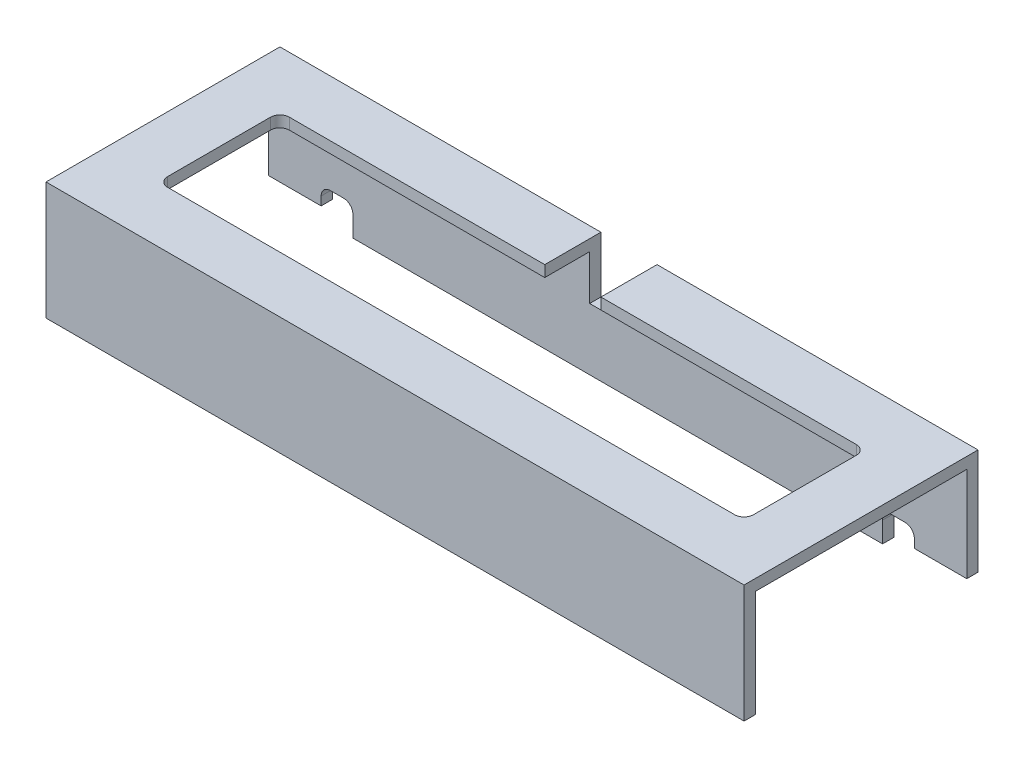
from build123d import *

# Parameters (mm, degrees)
BOSS_EXTRUDE1_DEPTH      = 311.5
BOSS_EXTRUDE1_DEPTH_BACK = 61.5
SKETCH2_R                = 4.34
SKETCH2_W                = 30
SKETCH2_H                = 24
SKETCH2_H_2              = 6
CORTAR_EXTRUIR1_DEPTH    = 30
CORTAR_EXTRUIR3_REACH    = 343.506
REDONDEO1_R              = 5


with BuildPart() as part:
    # Sketch1 → Boss-Extrude1 (new, two sides: drawn at the far end of the back side and taken through both)
    with BuildSketch(Plane(origin=(0, 0, 0), x_dir=(0, 0, -1), z_dir=(1, 0, 0)).offset(-BOSS_EXTRUDE1_DEPTH_BACK)):
        Polygon((0, 0), (6, 0), (6, 57), (119, 57), (119, 0), (125, 0), (125, 63), (0, 63), align=None)
    extrude(amount=BOSS_EXTRUDE1_DEPTH + BOSS_EXTRUDE1_DEPTH_BACK)

    # Sketch2 → Cortar-Extruir1 (cut)
    # profile 1 of 5: a face of its own
    with BuildSketch(Plane(origin=(0, 0, -125), x_dir=(-1, 0, 0), z_dir=(0, 0, -1))):
        Polygon((-311.5, 0), (-266.5, 0), (-266.5, 16), (-283.5, 16), (-283.5, 6.4), (-311.5, 6.4), align=None)
        with Locations((-277.52, 10.9)):
            Circle(SKETCH2_R, mode=Mode.SUBTRACT)
    # profile 2 of 5: a face of its own
    with BuildSketch(Plane(origin=(0, 0, -125), x_dir=(-1, 0, 0), z_dir=(0, 0, -1))):
        with Locations((-277.52, 10.9)):
            Circle(SKETCH2_R)
    # profile 3 of 5: a face of its own
    with BuildSketch(Plane(origin=(0, 0, -125), x_dir=(-1, 0, 0), z_dir=(0, 0, -1))):
        with Locations((-125, 45)):
            Rectangle(SKETCH2_W, SKETCH2_H)
    # profile 4 of 5: a face of its own
    with BuildSketch(Plane(origin=(0, 0, -125), x_dir=(-1, 0, 0), z_dir=(0, 0, -1))):
        with Locations((-125, 60)):
            Rectangle(SKETCH2_W, SKETCH2_H_2)
    # profile 5 of 5: a face of its own
    with BuildSketch(Plane(origin=(0, 0, -125), x_dir=(-1, 0, 0), z_dir=(0, 0, -1))):
        Polygon((16.5, 16), (16.5, 0), (61.5, 0), (61.5, 6.4), (33.5, 6.4), (33.5, 16), align=None)
    extrude(amount=-CORTAR_EXTRUIR1_DEPTH, mode=Mode.SUBTRACT)

    # Croquis1 → Cortar-Extruir3 (cut, up to next)
    with BuildSketch(Plane(origin=(0, 63, 0), x_dir=(1, 0, 0), z_dir=(0, 1, 0)), mode=Mode.PRIVATE) as cortar_extruir3_sk1:
        Polygon((-31.5, 95), (-31.5, 30), (281.5, 30), (281.5, 95), (170, 95), (140, 95), (110, 95), (80, 95), align=None)
    cortar_extruir3_tool1 = extrude(cortar_extruir3_sk1.sketch, amount=-CORTAR_EXTRUIR3_REACH, mode=Mode.PRIVATE) & part.part
    add(cortar_extruir3_tool1.solids().sort_by_distance((125, 63, -62.5))[0], mode=Mode.SUBTRACT)

    # Redondeo1
    redondeo1_edges = [part.edges().sort_by_distance(p)[0] for p in [
        (-16.5, 16, -122),
        (-33.5, 16, -122),
        (-31.5, 60, -95),
        (281.5, 60, -95),
        (281.5, 60, -30),
        (-31.5, 60, -30),
        (283.5, 16, -122),
        (266.5, 16, -122),
    ]]
    fillet(redondeo1_edges, radius=REDONDEO1_R)


solid = part.part
